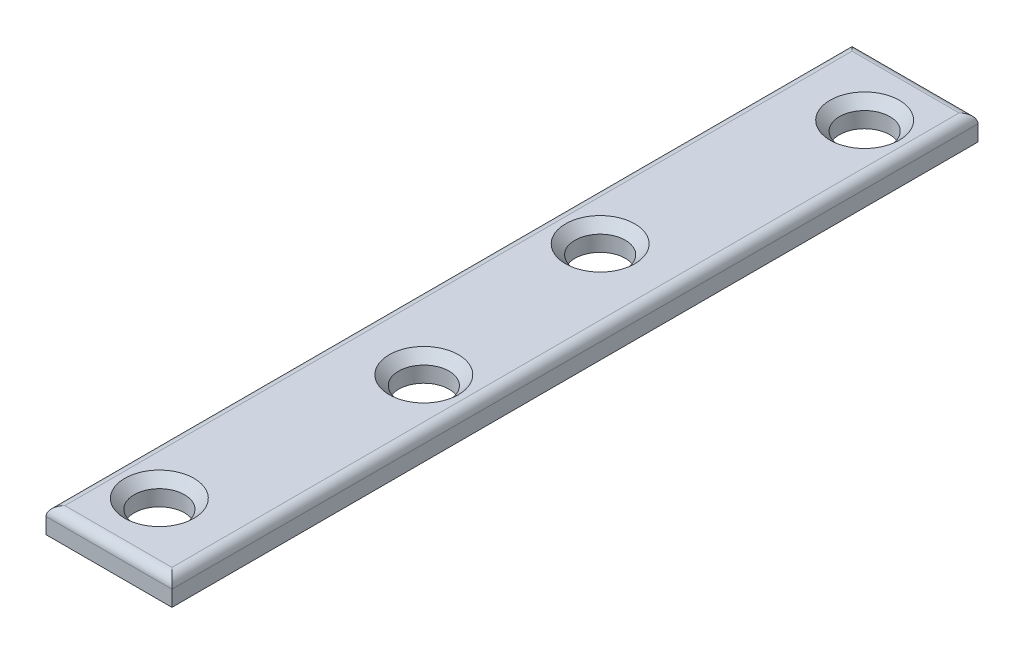
from build123d import *

# Parameters (mm, degrees)
SKETCH1_W           = 15.875
SKETCH1_H           = 101.6
BOSS_EXTRUDE1_DEPTH = 3.175
SKETCH2_R           = 3.175
CUT_EXTRUDE1_DEPTH  = 103.881758587
CHAMFER1_SIZE       = 1.190625
FILLET1_R           = 1.190625


with BuildPart() as part:
    # Sketch1 → Boss-Extrude1 (new body)
    with BuildSketch(Plane(origin=(0, 0, 0), x_dir=(1, 0, 0), z_dir=(0, 1, 0))):
        with Locations((7.9375, 50.8)):
            Rectangle(SKETCH1_W, SKETCH1_H)
    extrude(amount=BOSS_EXTRUDE1_DEPTH)

    # Sketch2 → Cut-Extrude1 (cut, through all)
    with BuildSketch(Plane(origin=(0, 3.175, 0), x_dir=(1, 0, 0), z_dir=(0, 1, 0))):
        with Locations(Location((6.35, 63.5, 0), (0, 0, 270))):
            Circle(SKETCH2_R)
        with Locations(Location((9.525, 93.6625, 0), (0, 0, 270))):
            Circle(SKETCH2_R)
        with Locations(Location((9.525, 38.1, 0), (0, 0, 270))):
            Circle(SKETCH2_R)
        with Locations(Location((6.35, 7.9375, 0), (0, 0, 270))):
            Circle(SKETCH2_R)
    extrude(amount=-CUT_EXTRUDE1_DEPTH, mode=Mode.SUBTRACT)

    # Chamfer1
    chamfer1_edges = [part.edges().sort_by_distance(p)[0] for p in [
        (6.35, 3.175, -66.675),
        (9.525, 3.175, -96.8375),
        (9.525, 3.175, -41.275),
        (6.35, 3.175, -11.1125),
    ]]
    chamfer(chamfer1_edges, length=CHAMFER1_SIZE)

    # Fillet1
    fillet1_edges = [part.edges().sort_by_distance(p)[0] for p in [
        (15.875, 3.175, -50.8),
        (7.9375, 3.175, -101.6),
        (0, 3.175, -50.8),
        (7.9375, 3.175, 0),
    ]]
    fillet(fillet1_edges, radius=FILLET1_R)


solid = part.part
